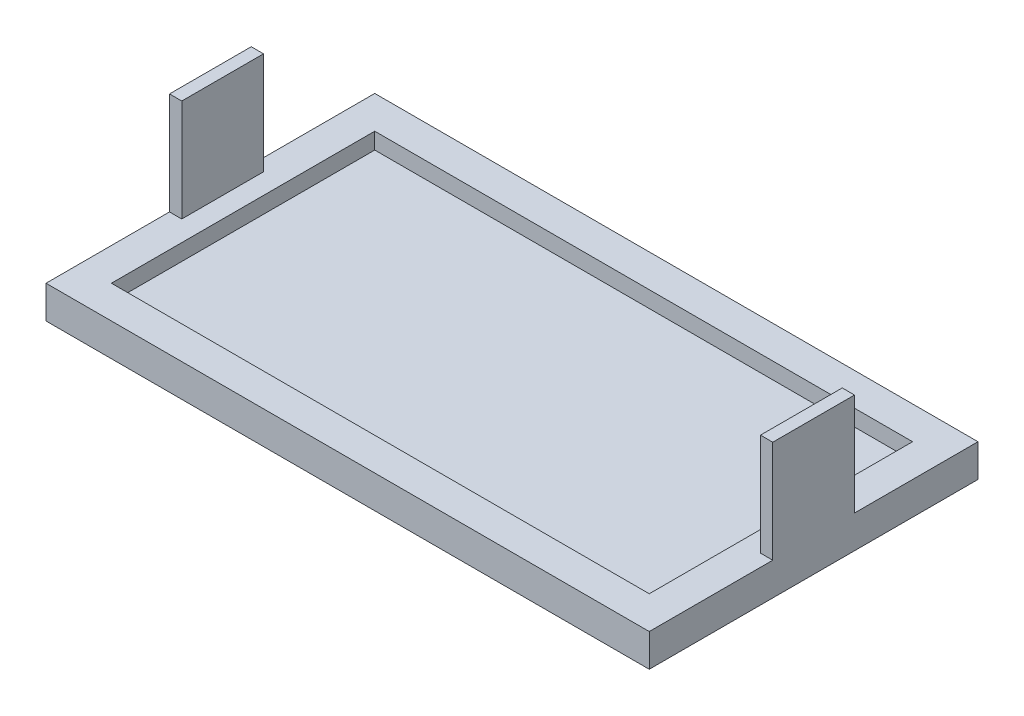
from build123d import *

# Parameters (mm, degrees)
SKETCH1_W           = 147.57
SKETCH1_H           = 80.42
BOSS_EXTRUDE1_DEPTH = 8
SKETCH2_W           = 131.57
SKETCH2_H           = 64.42
CUT_EXTRUDE1_DEPTH  = 4
SKETCH3_W           = 3
SKETCH3_H           = 20
BOSS_EXTRUDE2_DEPTH = 25


with BuildPart() as part:
    # Sketch1 → Boss-Extrude1 (new body)
    with BuildSketch(Plane(origin=(0, 0, 0), x_dir=(1, 0, 0), z_dir=(0, 1, 0))):
        with Locations((73.785, 40.21)):
            Rectangle(SKETCH1_W, SKETCH1_H)
    extrude(amount=BOSS_EXTRUDE1_DEPTH)

    # Sketch2 → Cut-Extrude1 (cut)
    with BuildSketch(Plane(origin=(0, 8, 0), x_dir=(1, 0, 0), z_dir=(0, 1, 0))):
        with Locations((73.785, 40.21)):
            Rectangle(SKETCH2_W, SKETCH2_H)
    extrude(amount=-CUT_EXTRUDE1_DEPTH, mode=Mode.SUBTRACT)

    # Sketch3 → Boss-Extrude2 (add)
    with BuildSketch(Plane(origin=(0, 8, 0), x_dir=(1, 0, 0), z_dir=(0, 1, 0))):
        with Locations((1.5, 40.21)):
            Rectangle(SKETCH3_W, SKETCH3_H)
    boss_extrude2 = extrude(amount=BOSS_EXTRUDE2_DEPTH)

    # Mirror1: Boss-Extrude2 across plane
    add(boss_extrude2.mirror(Plane.ZY.offset(-73.785)))


solid = part.part
